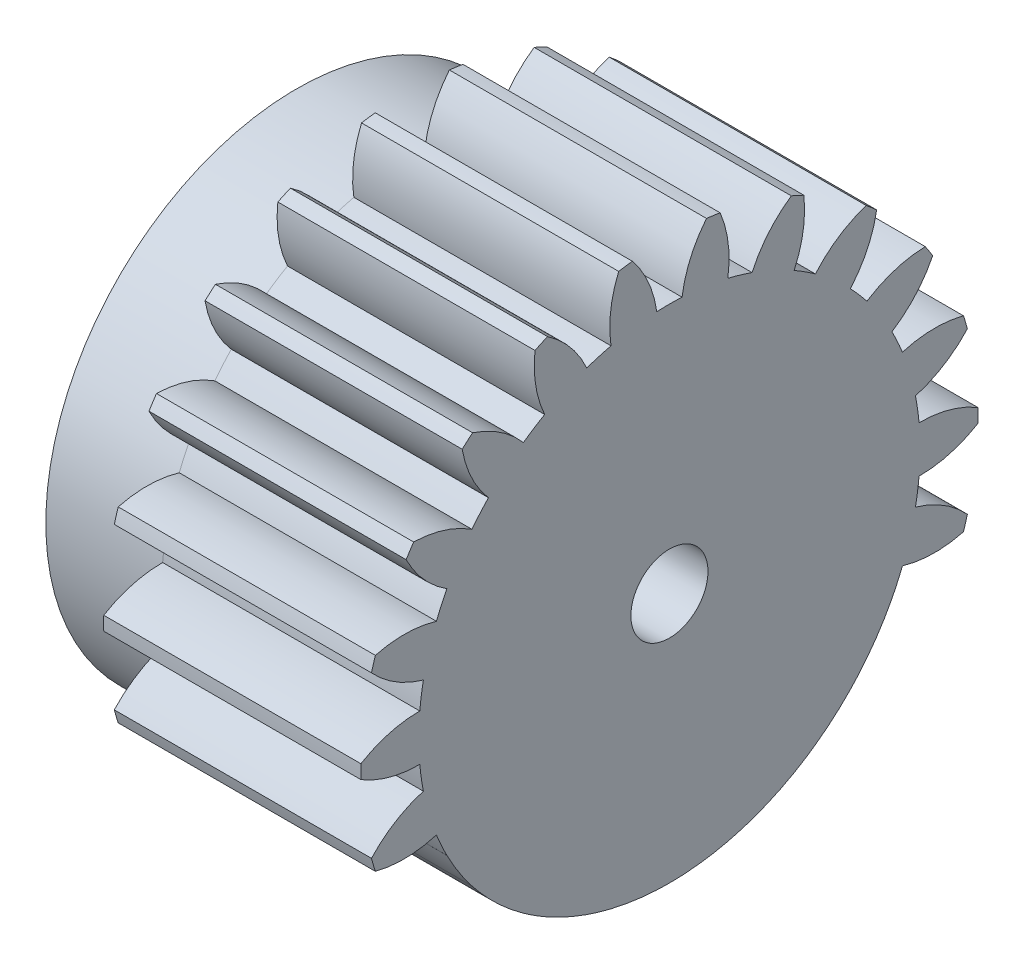
from build123d import *

# Parameters (mm, degrees)
SKETCH5_R           = 1.5
BOSS_EXTRUDE1_DEPTH = 10
SKETCH10_W          = 4.5
SKETCH10_H          = 6.3
CUT_EXTRUDE1_DEPTH  = 10
SKETCH13_R          = 4.1
CUT_EXTRUDE2_DEPTH  = 4.5
SKETCH14_R          = 3.25
CUT_EXTRUDE3_DEPTH  = 3


with BuildPart() as part:
    # Sketch5 → Boss-Extrude1 (new body)
    with BuildSketch(Plane(origin=(4.038890567, 0, 0), x_dir=(0, 0, -1), z_dir=(1, 0, 0))):
        with BuildLine():
            ThreePointArc((-8.767047038, 4.183890551), (-7.665653193, 3.710793481), (-6.477446097, 3.552511658))
            ThreePointArc((-6.477446097, 3.552511658), (-6.419815651, 3.06474668), (-6.337692385, 2.580503238))
            ThreePointArc((-6.337692385, 2.580503238), (-7.433175602, 2.093876318), (-8.35666841, 1.329644499))
            ThreePointArc((-8.35666841, 1.329644499), (-8.283962098, 1.071383356), (-8.205500024, 0.814812257))
            ThreePointArc((-8.205500024, 0.814812257), (-7.015433522, 0.671177447), (-5.830764019, 0.854063773))
            ThreePointArc((-5.830764019, 0.854063773), (-5.638048737, 0.402293077), (-5.422824897, -0.039198306))
            ThreePointArc((-5.422824897, -0.039198306), (-6.3368347, -0.814746704), (-7.007610576, -1.808199754))
            ThreePointArc((-7.007610576, -1.808199754), (-6.865088808, -2.035515771), (-6.717520569, -2.259588617))
            ThreePointArc((-6.717520569, -2.259588617), (-5.535193519, -2.06212473), (-4.450036487, -1.552886617))
            ThreePointArc((-4.450036487, -1.552886617), (-4.137849015, -1.932063257), (-3.806960756, -2.295035573))
            ThreePointArc((-3.806960756, -2.295035573), (-4.465449507, -3.296675131), (-4.829166179, -4.438865755))
            ThreePointArc((-4.829166179, -4.438865755), (-4.628375221, -4.616820854), (-4.423655917, -4.790242398))
            ThreePointArc((-4.423655917, -4.790242398), (-3.344853426, -4.267677163), (-2.447121834, -3.473342707))
            ThreePointArc((-2.447121834, -3.473342707), (-2.040753744, -3.749206653), (-1.621007666, -4.004254045))
            ThreePointArc((-1.621007666, -4.004254045), (-1.970628521, -5.150837883), (-1.997819828, -6.349232589))
            ThreePointArc((-1.997819828, -6.349232589), (-1.75502657, -6.463409906), (-1.50974134, -6.572130566))
            ThreePointArc((-1.50974134, -6.572130566), (-0.62186157, -5.76679911), (0.015715707, -4.751720564))
            ThreePointArc((0.015715707, -4.751720564), (0.483342889, -4.901922961), (0.957941455, -5.028383006))
            ThreePointArc((0.957941455, -5.028383006), (0.945512697, -6.22702172), (1.257049634, -7.384533696))
            ThreePointArc((1.257049634, -7.384533696), (1.522175527, -7.425683264), (1.788155131, -7.460895139))
            ThreePointArc((1.788155131, -7.460895139), (2.413181441, -6.438040628), (2.738951684, -5.284453619))
            ThreePointArc((2.738951684, -5.284453619), (3.229953586, -5.296825962), (3.720955487, -5.284453619))
            ThreePointArc((3.720955487, -5.284453619), (4.04672573, -6.438040628), (4.671752041, -7.460895139))
            ThreePointArc((4.671752041, -7.460895139), (4.937731645, -7.425683264), (5.202857538, -7.384533696))
            ThreePointArc((5.202857538, -7.384533696), (5.514394474, -6.22702172), (5.501965716, -5.028383006))
            ThreePointArc((5.501965716, -5.028383006), (5.976564282, -4.901922961), (6.444191465, -4.751720564))
            ThreePointArc((6.444191465, -4.751720564), (7.081768742, -5.76679911), (7.969648512, -6.572130566))
            ThreePointArc((7.969648512, -6.572130566), (8.214933742, -6.463409906), (8.457727, -6.349232589))
            ThreePointArc((8.457727, -6.349232589), (8.430535693, -5.150837883), (8.080914837, -4.004254045))
            ThreePointArc((8.080914837, -4.004254045), (8.500660915, -3.749206653), (8.907029006, -3.473342707))
            ThreePointArc((8.907029006, -3.473342707), (9.804760597, -4.267677163), (10.883563088, -4.790242398))
            ThreePointArc((10.883563088, -4.790242398), (11.088282393, -4.616820854), (11.289073351, -4.438865755))
            ThreePointArc((11.289073351, -4.438865755), (10.925356678, -3.296675131), (10.266867928, -2.295035573))
            ThreePointArc((10.266867928, -2.295035573), (10.597756186, -1.932063257), (10.909943659, -1.552886617))
            ThreePointArc((10.909943659, -1.552886617), (11.995100691, -2.06212473), (13.17742774, -2.259588617))
            ThreePointArc((13.17742774, -2.259588617), (13.32499598, -2.035515771), (13.467517748, -1.808199754))
            ThreePointArc((13.467517748, -1.808199754), (12.796741871, -0.814746704), (11.882732068, -0.039198306))
            ThreePointArc((11.882732068, -0.039198306), (12.097955909, 0.402293077), (12.290671191, 0.854063773))
            ThreePointArc((12.290671191, 0.854063773), (13.475340694, 0.671177447), (14.665407196, 0.814812257))
            ThreePointArc((14.665407196, 0.814812257), (14.743869269, 1.071383356), (14.816575582, 1.329644499))
            ThreePointArc((14.816575582, 1.329644499), (13.893082774, 2.093876318), (12.797599556, 2.580503238))
            ThreePointArc((12.797599556, 2.580503238), (12.879722823, 3.06474668), (12.937353269, 3.552511658))
            ThreePointArc((12.937353269, 3.552511658), (14.125560365, 3.710793481), (15.22695421, 4.183890551))
            ThreePointArc((15.22695421, 4.183890551), (15.229953586, 4.452174038), (15.22695421, 4.720457526))
            ThreePointArc((15.22695421, 4.720457526), (14.125560365, 5.193554596), (12.937353269, 5.351836419))
            ThreePointArc((12.937353269, 5.351836419), (12.879722823, 5.839601397), (12.797599556, 6.323844839))
            ThreePointArc((12.797599556, 6.323844839), (13.893082774, 6.810471759), (14.816575582, 7.574703578))
            ThreePointArc((14.816575582, 7.574703578), (14.743869269, 7.832964721), (14.665407196, 8.08953582))
            ThreePointArc((14.665407196, 8.08953582), (13.475340694, 8.23317063), (12.290671191, 8.050284304))
            ThreePointArc((12.290671191, 8.050284304), (12.097955909, 8.502055), (11.882732068, 8.943546382))
            ThreePointArc((11.882732068, 8.943546382), (12.796741871, 9.719094781), (13.467517748, 10.712547831))
            ThreePointArc((13.467517748, 10.712547831), (13.32499598, 10.939863848), (13.17742774, 11.163936694))
            ThreePointArc((13.17742774, 11.163936694), (11.995100691, 10.966472807), (10.909943659, 10.457234694))
            ThreePointArc((10.909943659, 10.457234694), (10.597756186, 10.836411334), (10.266867928, 11.19938365))
            ThreePointArc((10.266867928, 11.19938365), (10.925356678, 12.201023208), (11.289073351, 13.343213832))
            ThreePointArc((11.289073351, 13.343213832), (11.088282393, 13.521168931), (10.883563088, 13.694590475))
            ThreePointArc((10.883563088, 13.694590475), (9.804760597, 13.17202524), (8.907029006, 12.377690783))
            ThreePointArc((8.907029006, 12.377690783), (8.500660915, 12.65355473), (8.080914837, 12.908602122))
            ThreePointArc((8.080914837, 12.908602122), (8.430535693, 14.05518596), (8.457727, 15.253580666))
            ThreePointArc((8.457727, 15.253580666), (8.214933742, 15.367757983), (7.969648512, 15.476478643))
            ThreePointArc((7.969648512, 15.476478643), (7.081768742, 14.671147187), (6.444191465, 13.656068641))
            ThreePointArc((6.444191465, 13.656068641), (5.976564282, 13.806271038), (5.501965716, 13.932731083))
            ThreePointArc((5.501965716, 13.932731083), (5.514394474, 15.131369796), (5.202857538, 16.288881773))
            ThreePointArc((5.202857538, 16.288881773), (4.937731645, 16.330031341), (4.671752041, 16.365243215))
            ThreePointArc((4.671752041, 16.365243215), (4.04672573, 15.342388705), (3.720955487, 14.188801696))
            ThreePointArc((3.720955487, 14.188801696), (3.229953586, 14.201174038), (2.738951684, 14.188801696))
            ThreePointArc((2.738951684, 14.188801696), (2.413181441, 15.342388705), (1.788155131, 16.365243215))
            ThreePointArc((1.788155131, 16.365243215), (1.522175527, 16.330031341), (1.257049634, 16.288881773))
            ThreePointArc((1.257049634, 16.288881773), (0.945512697, 15.131369796), (0.957941455, 13.932731083))
            ThreePointArc((0.957941455, 13.932731083), (0.483342889, 13.806271038), (0.015715707, 13.656068641))
            ThreePointArc((0.015715707, 13.656068641), (-0.62186157, 14.671147187), (-1.50974134, 15.476478643))
            ThreePointArc((-1.50974134, 15.476478643), (-1.75502657, 15.367757983), (-1.997819828, 15.253580666))
            ThreePointArc((-1.997819828, 15.253580666), (-1.970628521, 14.05518596), (-1.621007666, 12.908602122))
            ThreePointArc((-1.621007666, 12.908602122), (-2.040753744, 12.65355473), (-2.447121834, 12.377690783))
            ThreePointArc((-2.447121834, 12.377690783), (-3.344853426, 13.17202524), (-4.423655917, 13.694590475))
            ThreePointArc((-4.423655917, 13.694590475), (-4.628375221, 13.521168931), (-4.829166179, 13.343213832))
            ThreePointArc((-4.829166179, 13.343213832), (-4.465449507, 12.201023208), (-3.806960756, 11.19938365))
            ThreePointArc((-3.806960756, 11.19938365), (-4.137849015, 10.836411334), (-4.450036487, 10.457234694))
            ThreePointArc((-4.450036487, 10.457234694), (-5.535193519, 10.966472807), (-6.717520569, 11.163936694))
            ThreePointArc((-6.717520569, 11.163936694), (-6.865088808, 10.939863848), (-7.007610576, 10.712547831))
            ThreePointArc((-7.007610576, 10.712547831), (-6.3368347, 9.719094781), (-5.422824897, 8.943546382))
            ThreePointArc((-5.422824897, 8.943546382), (-5.638048737, 8.502055), (-5.830764019, 8.050284304))
            ThreePointArc((-5.830764019, 8.050284304), (-7.015433522, 8.23317063), (-8.205500024, 8.08953582))
            ThreePointArc((-8.205500024, 8.08953582), (-8.283962098, 7.832964721), (-8.35666841, 7.574703578))
            ThreePointArc((-8.35666841, 7.574703578), (-7.433175602, 6.810471759), (-6.337692385, 6.323844839))
            ThreePointArc((-6.337692385, 6.323844839), (-6.419815651, 5.839601397), (-6.477446097, 5.351836419))
            ThreePointArc((-6.477446097, 5.351836419), (-7.665653193, 5.193554596), (-8.767047038, 4.720457526))
            ThreePointArc((-8.767047038, 4.720457526), (-8.770046414, 4.452174038), (-8.767047038, 4.183890551))
        make_face()
        with Locations((3.229953586, 4.452174038)):
            Circle(SKETCH5_R, mode=Mode.SUBTRACT)
    extrude(amount=-BOSS_EXTRUDE1_DEPTH)

    # Sketch11 → Cut-Extrude1 (cut)
    with BuildSketch(Plane(origin=(4.038890567, 0, 0), x_dir=(0, 0, -1), z_dir=(1, 0, 0))):
        with BuildLine():
            Line((-8.548250394, 0.266016969), (-5.575646279, 0.266016969))
            ThreePointArc((-5.575646279, 0.266016969), (3.229953586, -5.297825962), (12.035553451, 0.266016969))
            Line((12.035553451, 0.266016969), (15.008157566, 0.266016969))
            ThreePointArc((15.008157566, 0.266016969), (3.229953586, -8.047825962), (-8.548250394, 0.266016969))
        make_face()
    extrude(amount=-CUT_EXTRUDE1_DEPTH, mode=Mode.SUBTRACT)

    # Sketch14 → Cut-Extrude3 (cut)
    with BuildSketch(Plane.ZY.offset(5.961109433)):
        with Locations((-3.229953586, 4.452174038)):
            Circle(SKETCH14_R)
    extrude(amount=-CUT_EXTRUDE3_DEPTH, mode=Mode.SUBTRACT)


with BuildPart() as body_2:
    # Sketch10 → Revolve2 (revolve)
    with BuildSketch(Plane.XY.offset(-3.229953586), mode=Mode.PRIVATE) as revolve2_sk:
        with Locations((-8.211109433, 11.052174038)):
            Rectangle(SKETCH10_W, SKETCH10_H)
    revolve(revolve2_sk.sketch.rotate(Axis((-10.461109433, 4.452174038, -3.229953586), (1, 0, 0)), 270), axis=Axis((-10.461109433, 4.452174038, -3.229953586), (1, 0, 0)))

    # Sketch13 → Cut-Extrude2 (cut)
    with BuildSketch(Plane.ZY.offset(10.461109433)):
        with Locations((-3.229953586, 4.452174038)):
            Circle(SKETCH13_R)
    extrude(amount=-CUT_EXTRUDE2_DEPTH, mode=Mode.SUBTRACT)


solid = Compound([part.part, body_2.part])
